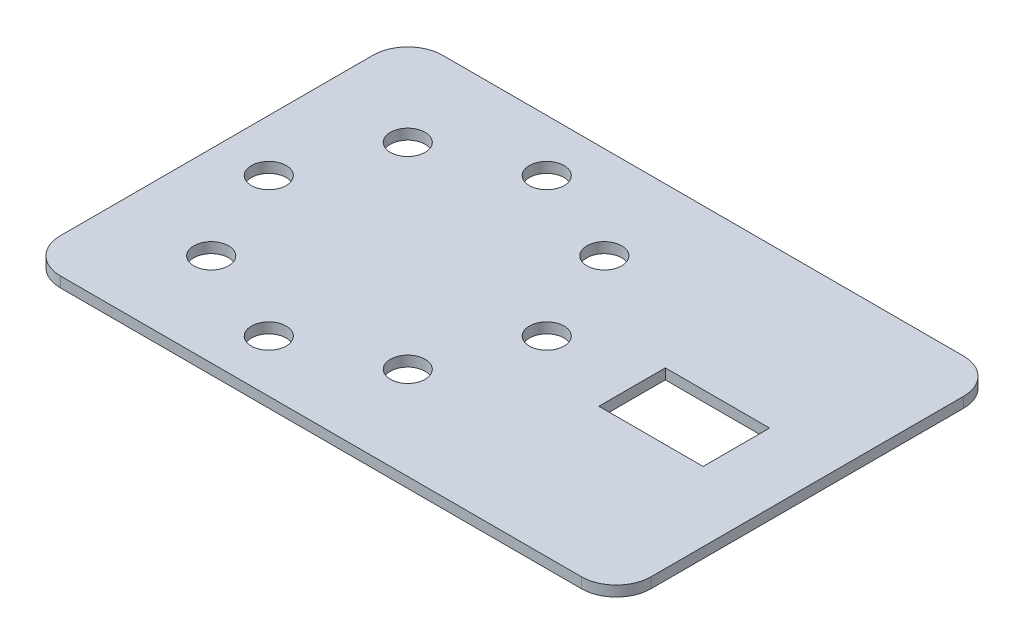
from build123d import *

# Parameters (mm, degrees)
SKETCH1_W           = 85
SKETCH1_H           = 55
SKETCH1_R           = 2.5
SKETCH1_W_2         = 15
SKETCH1_H_2         = 9.566733068
BOSS_EXTRUDE1_DEPTH = 1.5
FILLET1_R           = 5


with BuildPart() as part:
    # Sketch1 → Boss-Extrude1 (new body)
    with BuildSketch(Plane(origin=(0, 0, 0), x_dir=(1, 0, 0), z_dir=(0, 1, 0))):
        Rectangle(SKETCH1_W, SKETCH1_H)
        with Locations(Location((-35, 0, 0), (0, 0, 270))):
            Circle(SKETCH1_R, mode=Mode.SUBTRACT)
        with Locations(Location((-29.142135624, 14.142135624, 0), (0, 0, 270))):
            Circle(SKETCH1_R, mode=Mode.SUBTRACT)
        with Locations(Location((-15, 20, 0), (0, 0, 270))):
            Circle(SKETCH1_R, mode=Mode.SUBTRACT)
        with Locations(Location((-0.857864376, 14.142135624, 0), (0, 0, 270))):
            Circle(SKETCH1_R, mode=Mode.SUBTRACT)
        with Locations(Location((5, 0, 0), (0, 0, 270))):
            Circle(SKETCH1_R, mode=Mode.SUBTRACT)
        with Locations(Location((-0.857864376, -14.142135624, 0), (0, 0, 270))):
            Circle(SKETCH1_R, mode=Mode.SUBTRACT)
        with Locations(Location((-15, -20, 0), (0, 0, 270))):
            Circle(SKETCH1_R, mode=Mode.SUBTRACT)
        with Locations(Location((-29.142135624, -14.142135624, 0), (0, 0, 270))):
            Circle(SKETCH1_R, mode=Mode.SUBTRACT)
        with Locations((25, -0.216633466)):
            Rectangle(SKETCH1_W_2, SKETCH1_H_2, mode=Mode.SUBTRACT)
    extrude(amount=BOSS_EXTRUDE1_DEPTH)

    # Fillet1
    fillet1_edges = [part.edges().sort_by_distance(p)[0] for p in [
        (-42.5, 0.75, -27.5),
        (42.5, 0.75, -27.5),
        (42.5, 0.75, 27.5),
        (-42.5, 0.75, 27.5),
    ]]
    fillet(fillet1_edges, radius=FILLET1_R)


solid = part.part
